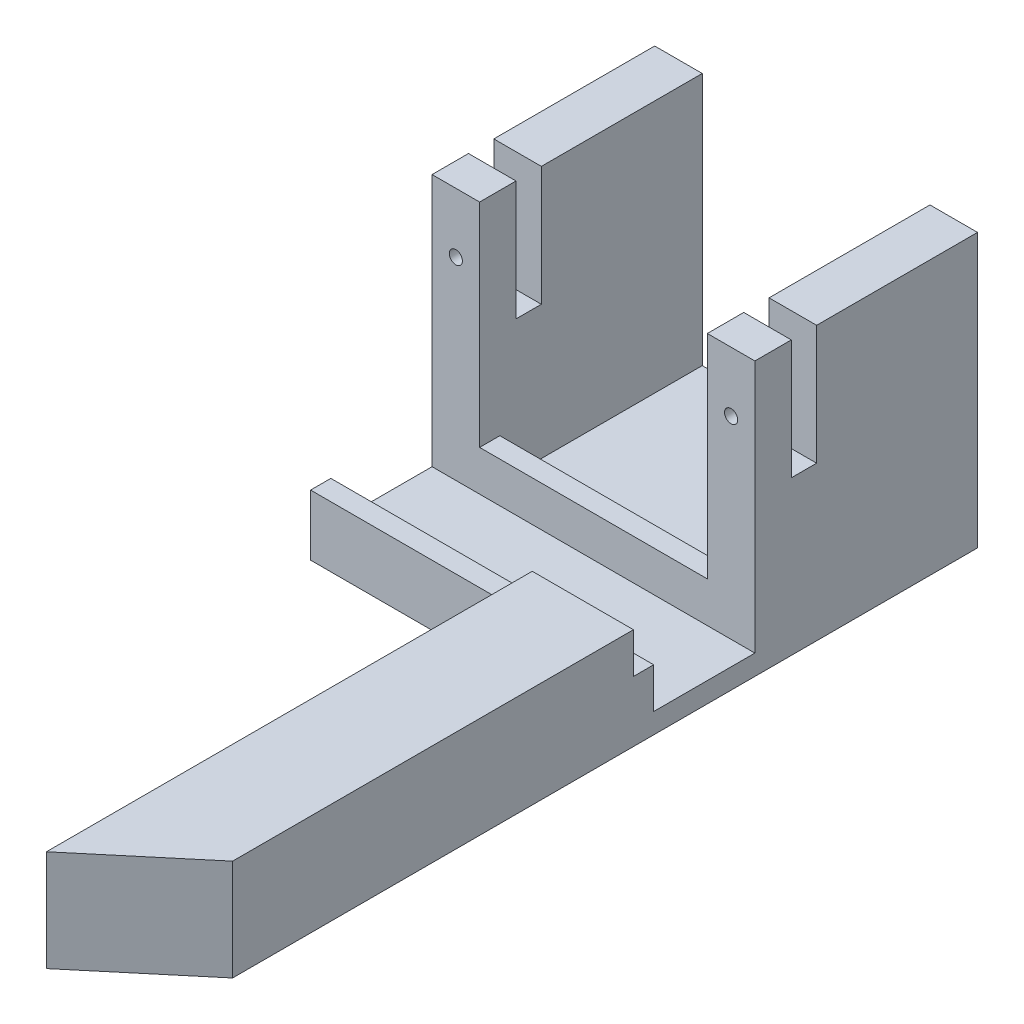
from build123d import *

# Parameters (mm, degrees)
SKETCH1_W           = 31.9
SKETCH1_H           = 34
BOSS_EXTRUDE3_DEPTH = 2
SKETCH2_W           = 4.7
SKETCH2_H           = 22
BOSS_EXTRUDE4_DEPTH = 25
SKETCH3_W           = 22.5
SKETCH3_H           = 2
SKETCH3_W_2         = 31.9
BOSS_EXTRUDE5_DEPTH = 4
SKETCH6_W           = 27.2
SKETCH6_H           = 2.5
SKETCH6_W_2         = 4.7
CUT_EXTRUDE1_DEPTH  = 11.8
SKETCH7_R           = 0.65
CUT_EXTRUDE2_DEPTH  = 4
BOSS_EXTRUDE6_DEPTH = 10


with BuildPart() as part:
    # Sketch1 → Boss-Extrude3 (new body)
    with BuildSketch(Plane(origin=(0, 0, 0), x_dir=(1, 0, 0), z_dir=(0, 1, 0))):
        Rectangle(SKETCH1_W, SKETCH1_H)
    extrude(amount=BOSS_EXTRUDE3_DEPTH)

    # Sketch2 → Boss-Extrude4 (add)
    with BuildSketch(Plane(origin=(0, 2, 0), x_dir=(1, 0, 0), z_dir=(0, 1, 0))):
        with Locations((-13.6, 6)):
            Rectangle(SKETCH2_W, SKETCH2_H)
        with Locations((13.6, 6)):
            Rectangle(SKETCH2_W, SKETCH2_H)
    extrude(amount=BOSS_EXTRUDE4_DEPTH)

    # Sketch3 → Boss-Extrude5 (add)
    with BuildSketch(Plane(origin=(0, 2, 0), x_dir=(1, 0, 0), z_dir=(0, 1, 0))):
        with Locations((0, -4)):
            Rectangle(SKETCH3_W, SKETCH3_H)
        with Locations((0, -16)):
            Rectangle(SKETCH3_W_2, SKETCH3_H)
    extrude(amount=BOSS_EXTRUDE5_DEPTH)

    # Sketch6 → Cut-Extrude1 (cut)
    with BuildSketch(Plane(origin=(0, 27, 0), x_dir=(1, 0, 0), z_dir=(0, 1, 0))):
        with Locations((2.35, -0.15)):
            Rectangle(SKETCH6_W, SKETCH6_H)
        with Locations((-13.6, -0.15)):
            Rectangle(SKETCH6_W_2, SKETCH6_H)
    extrude(amount=-CUT_EXTRUDE1_DEPTH, mode=Mode.SUBTRACT)

    # Sketch7 → Cut-Extrude2 (cut)
    with BuildSketch(Plane.XY.offset(5)):
        with Locations((-13.6, 21.1)):
            Circle(SKETCH7_R)
        with Locations((13.6, 21.1)):
            Circle(SKETCH7_R)
    extrude(amount=-CUT_EXTRUDE2_DEPTH, mode=Mode.SUBTRACT)

    # Sketch8 → Boss-Extrude6 (add)
    with BuildSketch(Plane(origin=(0, 0, 0), x_dir=(1, 0, 0), z_dir=(0, 1, 0))):
        Polygon((5.95, -65), (15.95, -56.609003688), (15.95, -17), (5.95, -17), align=None)
    extrude(amount=BOSS_EXTRUDE6_DEPTH)


solid = part.part
